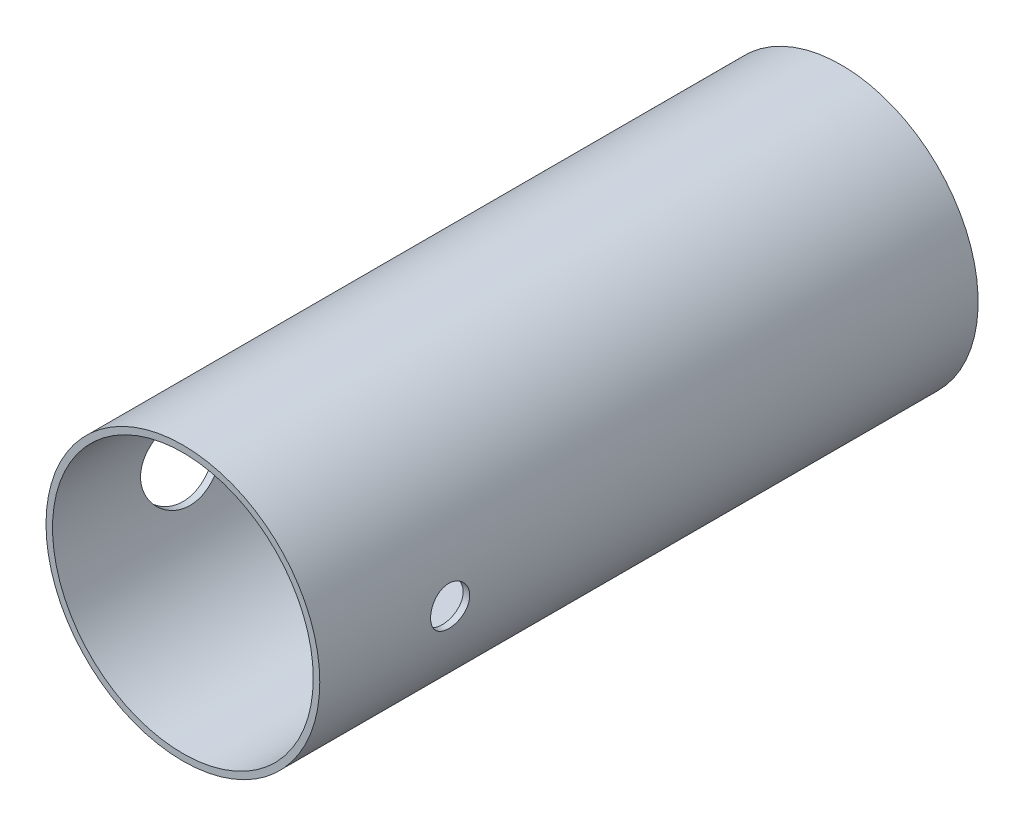
from build123d import *

# Parameters (mm, degrees)
SKETCH1_R               = 21
SKETCH1_R_2             = 20
BOSS_EXTRUDE1_DEPTH     = 100
CUT_EXTRUDE1_REACH      = 112.476
CUT_EXTRUDE1_END_RADIUS = 20
SKETCH2_R               = 6.5
CUT_EXTRUDE3_REACH      = 112.476
SKETCH5_R               = 3
BOSS_EXTRUDE2_START     = 1
SKETCH3_R               = 21
BOSS_EXTRUDE2_DEPTH     = 1
CUT_EXTRUDE2_REACH      = 107.276
SKETCH4_R               = 6.5


with BuildPart() as part:
    # Sketch1 → Boss-Extrude1 (new body)
    with BuildSketch(Plane.XY):
        Circle(SKETCH1_R)
        Circle(SKETCH1_R_2, mode=Mode.SUBTRACT)
    extrude(amount=BOSS_EXTRUDE1_DEPTH)

    # Cut-Extrude1: up to this cylinder (the profile starts outside it)
    cut_extrude1_end = Plane(origin=(0, 0, 80), z_dir=(0, 0, -1)) * Cylinder(CUT_EXTRUDE1_END_RADIUS, 265.952, mode=Mode.PRIVATE)
    # Sketch2 → Cut-Extrude1 (cut, up to the surface)
    with BuildSketch(Plane.ZY.offset(21), mode=Mode.PRIVATE) as cut_extrude1_sk1:
        with Locations((80, 0)):
            Circle(SKETCH2_R)
    cut_extrude1_tool1 = extrude(cut_extrude1_sk1.sketch, amount=-CUT_EXTRUDE1_REACH, mode=Mode.PRIVATE) - cut_extrude1_end
    add(cut_extrude1_tool1.solids().sort_by_distance((-21, 0, 80))[0], mode=Mode.SUBTRACT)

    # Sketch5 → Cut-Extrude3 (cut, up to next)
    with BuildSketch(Plane.ZY.offset(21), mode=Mode.PRIVATE) as cut_extrude3_sk1:
        with Locations((80, 0)):
            Circle(SKETCH5_R)
    cut_extrude3_tool1 = extrude(cut_extrude3_sk1.sketch, amount=-CUT_EXTRUDE3_REACH, mode=Mode.PRIVATE) & part.part
    add(cut_extrude3_tool1.solids().sort_by_distance((-21, 0, 80))[0], mode=Mode.SUBTRACT)

    # Sketch3 → Boss-Extrude2 (add)
    with BuildSketch(Plane(origin=(0, 0, 0), x_dir=(-1, 0, 0), z_dir=(0, 0, -1)).offset(BOSS_EXTRUDE2_START)):
        Circle(SKETCH3_R)
    extrude(amount=-BOSS_EXTRUDE2_DEPTH)

    # Sketch4 → Cut-Extrude2 (cut, up to next)
    with BuildSketch(Plane(origin=(0, 0, -1), x_dir=(-1, 0, 0), z_dir=(0, 0, -1)), mode=Mode.PRIVATE) as cut_extrude2_sk1:
        with Locations((2.632276964, 6.486225249)):
            Circle(SKETCH4_R)
    cut_extrude2_tool1 = extrude(cut_extrude2_sk1.sketch, amount=-CUT_EXTRUDE2_REACH, mode=Mode.PRIVATE) & part.part
    add(cut_extrude2_tool1.solids().sort_by_distance((-2.632277, 6.486225, -1))[0], mode=Mode.SUBTRACT)


solid = part.part
